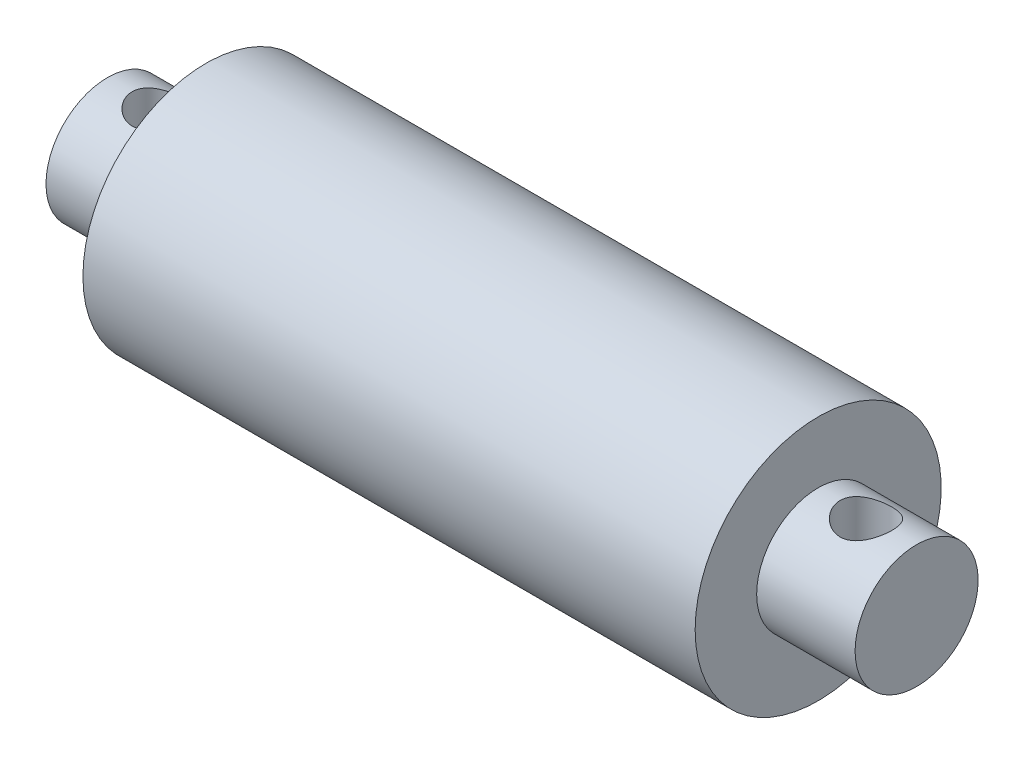
from build123d import *

# Parameters (mm, degrees)
CUT_EXTRUDE1_DEPTH      = 10
CUT_EXTRUDE1_DEPTH_BACK = 10
SKETCH2_R               = 2
SKETCH2_R_2             = 2.107972828


with BuildPart() as part:
    # Sketch1 → Revolve1 (revolve)
    with BuildSketch(Plane.XY):
        Polygon((0, 0), (50, 0), (57.761374705, 0), (57.761374705, 5), (49.761374705, 5), (49.761374705, 10), (0, 10), (0, 5), (-8, 5), (-8, 0), align=None)
    revolve(axis=Axis((0, 0, 0), (1, 0, 0)))

    # Sketch2 → Cut-Extrude1 (cut, two sides: drawn at the far end of the back side and taken through both)
    with BuildSketch(Plane(origin=(0, 0, 0), x_dir=(1, 0, 0), z_dir=(0, 1, 0)).offset(-CUT_EXTRUDE1_DEPTH_BACK)):
        with Locations((-4, 0)):
            Circle(SKETCH2_R)
        with Locations((53.652209211, 0)):
            Circle(SKETCH2_R_2)
    extrude(amount=CUT_EXTRUDE1_DEPTH + CUT_EXTRUDE1_DEPTH_BACK, mode=Mode.SUBTRACT)


solid = part.part
